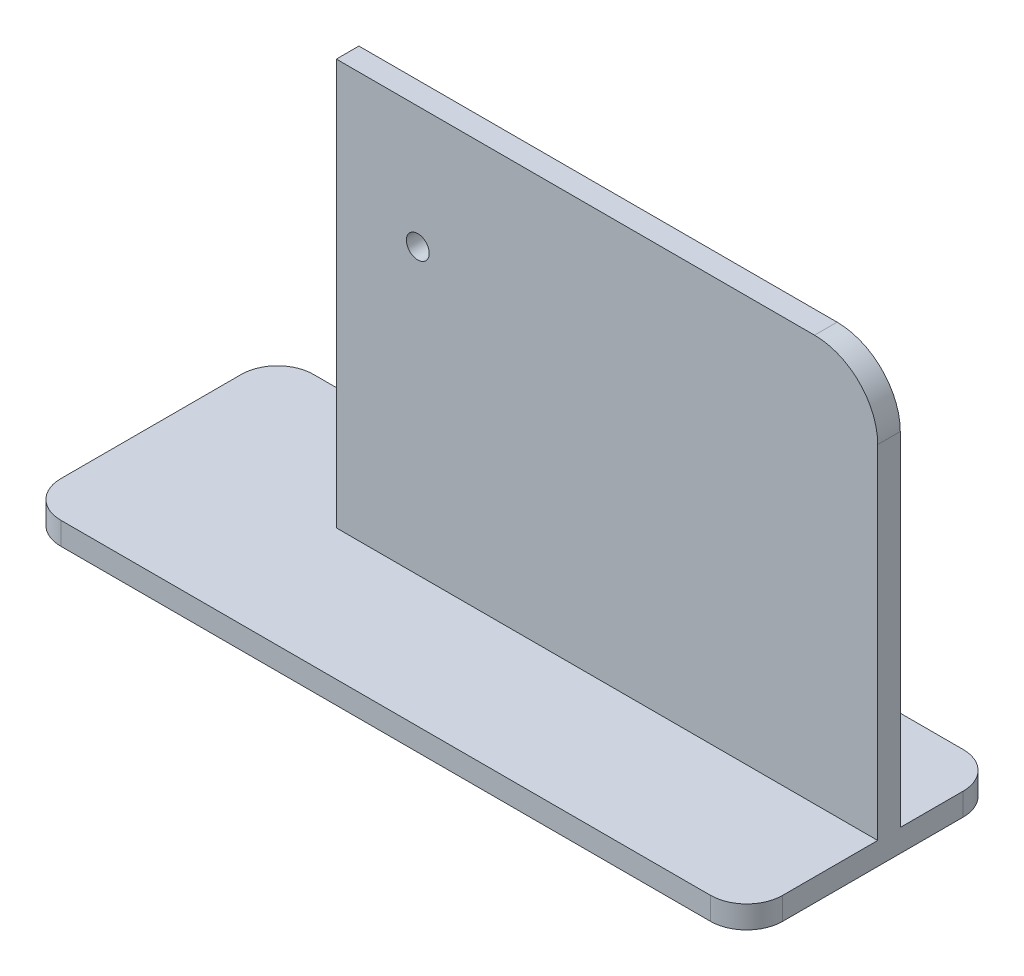
from build123d import *

# Parameters (mm, degrees)
CROQUIS4_R              = 1.267922183
SALIENTE_EXTRUIR3_DEPTH = 2.5
SALIENTE_EXTRUIR4_DEPTH = 2.5


with BuildPart() as part:
    # Croquis4 → Saliente-Extruir3 (new body)
    with BuildSketch(Plane.XY):
        with BuildLine():
            Line((30.406912218, -15.136800989), (30.406912218, 22.863199011))
            ThreePointArc((30.406912218, 22.863199011), (28.356659686, 27.812946479), (23.406912218, 29.863199011))
            Line((23.406912218, 29.863199011), (-29.593087782, 29.863199011))
            Line((-29.593087782, 29.863199011), (-29.593087782, -15.136800989))
            Line((-29.593087782, -15.136800989), (30.406912218, -15.136800989))
        make_face()
        with Locations((-20.564298519, 16.363199011)):
            Circle(CROQUIS4_R, mode=Mode.SUBTRACT)
    extrude(amount=SALIENTE_EXTRUIR3_DEPTH)

    # Croquis5 → Saliente-Extruir4 (add)
    with BuildSketch(Plane.XZ.offset(15.136800989)):
        with BuildLine():
            Line((30.406912218, 13.031466978), (30.406912218, -6.968533022))
            ThreePointArc((30.406912218, -6.968533022), (29.235339342, -9.796960146), (26.406912218, -10.968533022))
            Line((26.406912218, -10.968533022), (-45.593087782, -10.968533022))
            ThreePointArc((-45.593087782, -10.968533022), (-48.421514907, -9.796960146), (-49.593087782, -6.968533022))
            Line((-49.593087782, -6.968533022), (-49.593087782, 13.031466978))
            ThreePointArc((-49.593087782, 13.031466978), (-48.421514907, 15.859894103), (-45.593087782, 17.031466978))
            Line((-45.593087782, 17.031466978), (26.406912218, 17.031466978))
            ThreePointArc((26.406912218, 17.031466978), (29.235339342, 15.859894103), (30.406912218, 13.031466978))
        make_face()
    extrude(amount=SALIENTE_EXTRUIR4_DEPTH)


solid = part.part
